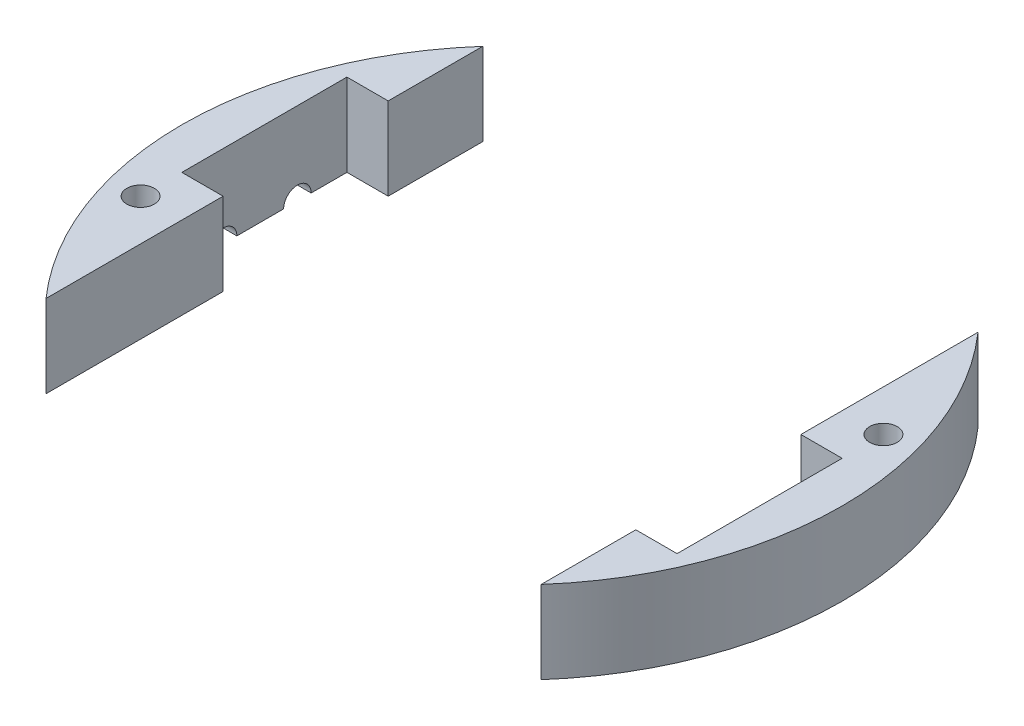
from build123d import *

# Parameters (mm, degrees)
BOSS_EXTRUDE1_DEPTH   = 15
BOSS_EXTRUDE1_2_DEPTH = 15
SKETCH3_R             = 2.5
CUT_EXTRUDE3_DEPTH    = 2.5
SKETCH3_3_R           = 2.5
CUT_EXTRUDE4_DEPTH    = 5.5
CUT_EXTRUDE5_START    = -5.5
SKETCH2_R             = 2.5
CUT_EXTRUDE5_DEPTH    = 5.5
SKETCH2_3_R           = 2.5
CUT_EXTRUDE6_DEPTH    = 2.5
SKETCH4_R             = 2.5
CUT_EXTRUDE7_DEPTH    = 74.484692283


with BuildPart() as part:
    # Sketch1 → Boss-Extrude1 (new body)
    with BuildSketch(Plane(origin=(0, 0, 0), x_dir=(1, 0, 0), z_dir=(0, 1, 0))):
        with BuildLine():
            Line((-45, 22.5), (-45, 39.686269666))
            ThreePointArc((-45, 39.686269666), (-60, 0), (-45, -39.686269666))
            Line((-45, -39.686269666), (-45, -7.5))
            Line((-45, -7.5), (-52.5, -7.5))
            Line((-52.5, -7.5), (-52.5, 7.5))
            Line((-52.5, 7.5), (-52.5, 22.5))
            Line((-52.5, 22.5), (-45, 22.5))
        make_face()
    extrude(amount=BOSS_EXTRUDE1_DEPTH)

    # Sketch3 → Cut-Extrude3 (cut)
    with BuildSketch(Plane(origin=(-52.5, 0, 0), x_dir=(0, 0, -1), z_dir=(1, 0, 0))):
        with Locations((13.5, 0)):
            Circle(SKETCH3_R)
    extrude(amount=-CUT_EXTRUDE3_DEPTH, mode=Mode.SUBTRACT)

    # Sketch3<3> → Cut-Extrude4 (cut)
    with BuildSketch(Plane(origin=(-52.5, 0, 0), x_dir=(0, 0, -1), z_dir=(1, 0, 0))):
        Circle(SKETCH3_3_R)
    extrude(amount=-CUT_EXTRUDE4_DEPTH, mode=Mode.SUBTRACT)


with BuildPart() as body_2:
    # Sketch1 → Boss-Extrude1 2 (new body)
    with BuildSketch(Plane(origin=(0, 0, 0), x_dir=(1, 0, 0), z_dir=(0, 1, 0))):
        with BuildLine():
            Line((45, 7.5), (52.5, 7.5))
            Line((52.5, 7.5), (52.5, -7.5))
            Line((52.5, -7.5), (52.5, -22.5))
            Line((52.5, -22.5), (45, -22.5))
            Line((45, -22.5), (45, -39.686269666))
            ThreePointArc((45, -39.686269666), (60, 0), (45, 39.686269666))
            Line((45, 39.686269666), (45, 7.5))
        make_face()
    extrude(amount=BOSS_EXTRUDE1_2_DEPTH)

    # Sketch2 → Cut-Extrude5 (cut)
    with BuildSketch(Plane.ZY.offset(-52.5).offset(CUT_EXTRUDE5_START)):
        Circle(SKETCH2_R)
    extrude(amount=CUT_EXTRUDE5_DEPTH, mode=Mode.SUBTRACT)

    # Sketch2<3> → Cut-Extrude6 (cut)
    with BuildSketch(Plane.ZY.offset(-52.5)):
        with Locations((13.5, 0)):
            Circle(SKETCH2_3_R)
    extrude(amount=-CUT_EXTRUDE6_DEPTH, mode=Mode.SUBTRACT)


with BuildPart() as cut_extrude7_tool:
    # Sketch4 → Cut-Extrude7 (new, through all)
    with BuildSketch(Plane(origin=(0, 15, 0), x_dir=(1, 0, 0), z_dir=(0, 1, 0))):
        with Locations((52.5, 15)):
            Circle(SKETCH4_R)
        with Locations((-52.5, -15)):
            Circle(SKETCH4_R)
    extrude(amount=-CUT_EXTRUDE7_DEPTH)


with BuildPart() as part_1:
    add(part.part)

    # Cut-Extrude7: cut by cut_extrude7_tool
    add(cut_extrude7_tool.part, mode=Mode.SUBTRACT)


with BuildPart() as body_2_1:
    add(body_2.part)

    # Cut-Extrude7: cut by cut_extrude7_tool
    add(cut_extrude7_tool.part, mode=Mode.SUBTRACT)


solid = Compound([part_1.part, body_2_1.part])
